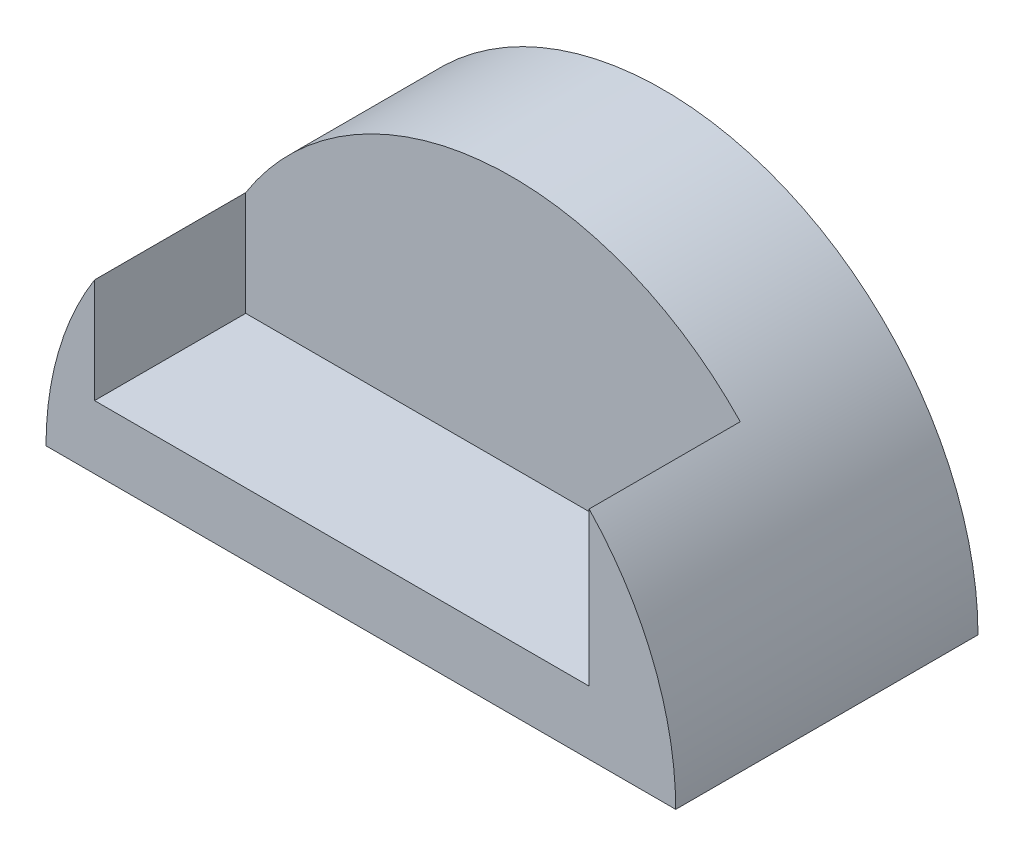
from build123d import *

# Parameters (mm, degrees)
BOSS_EXTRUDE1_DEPTH = 7.62
CUT_EXTRUDE1_DEPTH  = 24.708556472


with BuildPart() as part:
    # Sketch1 → Boss-Extrude1 (new, symmetric)
    with BuildSketch(Plane.XY):
        with BuildLine():
            Line((-15.875, 0), (15.875, 0))
            ThreePointArc((15.875, 0), (0, 15.875), (-15.875, 0))
        make_face()
    extrude(amount=BOSS_EXTRUDE1_DEPTH, both=True)

    # Sketch2 → Cut-Extrude1 (cut, through all)
    with BuildSketch(Plane.XY):
        with BuildLine():
            Line((-13.426650235, 8.469987513), (-13.426650235, 3.198682523))
            Line((-13.426650235, 3.198682523), (11.508557344, 3.198682523))
            Line((11.508557344, 3.198682523), (11.508557344, 10.93474887))
            ThreePointArc((11.508557344, 10.93474887), (-1.56158004, 15.79800914), (-13.426650235, 8.469987513))
        make_face()
    extrude(amount=CUT_EXTRUDE1_DEPTH, mode=Mode.SUBTRACT)


solid = part.part
